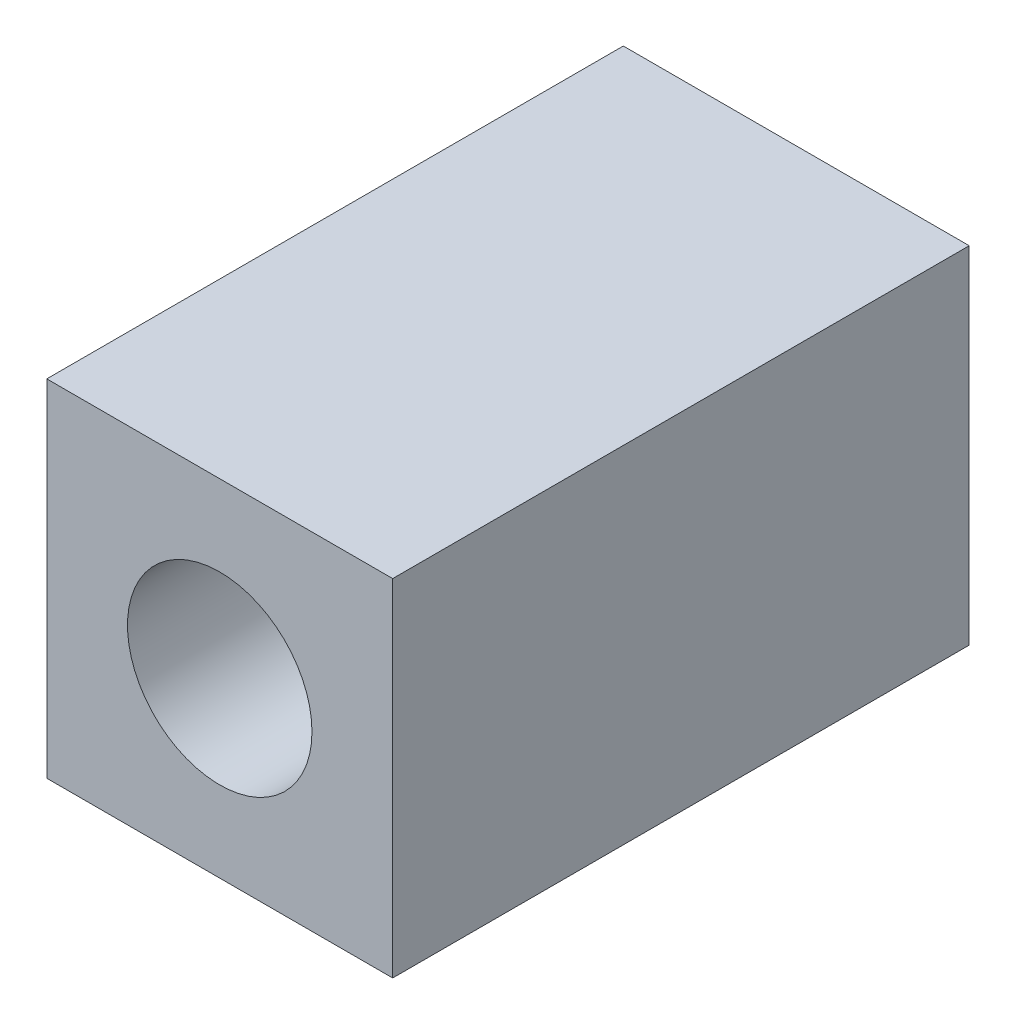
from build123d import *

# Parameters (mm, degrees)
SKETCH_1_W          = 15
SKETCH_1_H          = 15
EXTRUDE_1_DEPTH     = 25
SKETCH_2_R          = 4
CUT_EXTRUDE_1_DEPTH = 28.156951228


with BuildPart() as part:
    # Эскиз1 → Бобышка-Вытянуть1 (new body)
    with BuildSketch(Plane.XY):
        Rectangle(SKETCH_1_W, SKETCH_1_H)
    extrude(amount=EXTRUDE_1_DEPTH)

    # Эскиз2 → Вырез-Вытянуть1 (cut, through all)
    with BuildSketch(Plane.XY.offset(25)):
        Circle(SKETCH_2_R)
    extrude(amount=-CUT_EXTRUDE_1_DEPTH, mode=Mode.SUBTRACT)


solid = part.part
